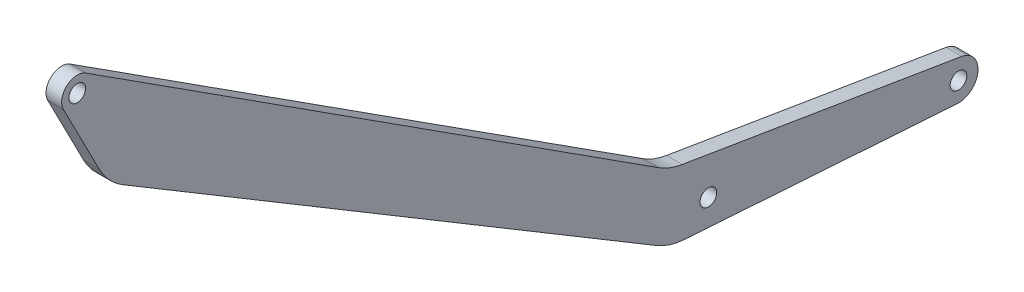
from build123d import *

# Parameters (mm, degrees)
SKETCH1_R           = 3.3782
BOSS_EXTRUDE1_DEPTH = 3.175
FILLET1_R           = 25.4


with BuildPart() as part:
    # Sketch1 → Boss-Extrude1 (new, symmetric)
    with BuildSketch(Plane(origin=(-76.913317281, 0, 0), x_dir=(0, 0, -1), z_dir=(1, 0, 0))):
        with BuildLine():
            Line((535.218804975, 907.961983625), (418.2911251, 916.04381761))
            Line((418.2911251, 916.04381761), (190.115926381, 1052.658490892))
            Line((190.115926381, 1052.658490892), (172.155048622, 1087.522632949))
            ThreePointArc((172.155048622, 1087.522632949), (173.529973777, 1095.130662847), (181.234623159, 1095.771690164))
            Line((181.234623159, 1095.771690164), (418.2911251, 943.327259155))
            Line((418.2911251, 943.327259155), (537.059525989, 923.712003677))
            ThreePointArc((537.059525989, 923.712003677), (543.649965664, 914.959198723), (535.218804975, 907.961983625))
        make_face()
        with Locations((177.8, 1090.430729224)):
            Circle(SKETCH1_R, mode=Mode.SUBTRACT)
        with Locations((434.1661251, 925.56881761)):
            Circle(SKETCH1_R, mode=Mode.SUBTRACT)
        with Locations((535.7661251, 915.880591264)):
            Circle(SKETCH1_R, mode=Mode.SUBTRACT)
    extrude(amount=BOSS_EXTRUDE1_DEPTH, both=True)

    # Fillet1
    fillet1_edges = [part.edges().sort_by_distance(p)[0] for p in [
        (-76.913317281, 916.04381761, -418.2911251),
        (-76.913317281, 1052.658490892, -190.115926381),
        (-76.913317281, 943.327259155, -418.2911251),
    ]]
    fillet(fillet1_edges, radius=FILLET1_R)


solid = part.part
